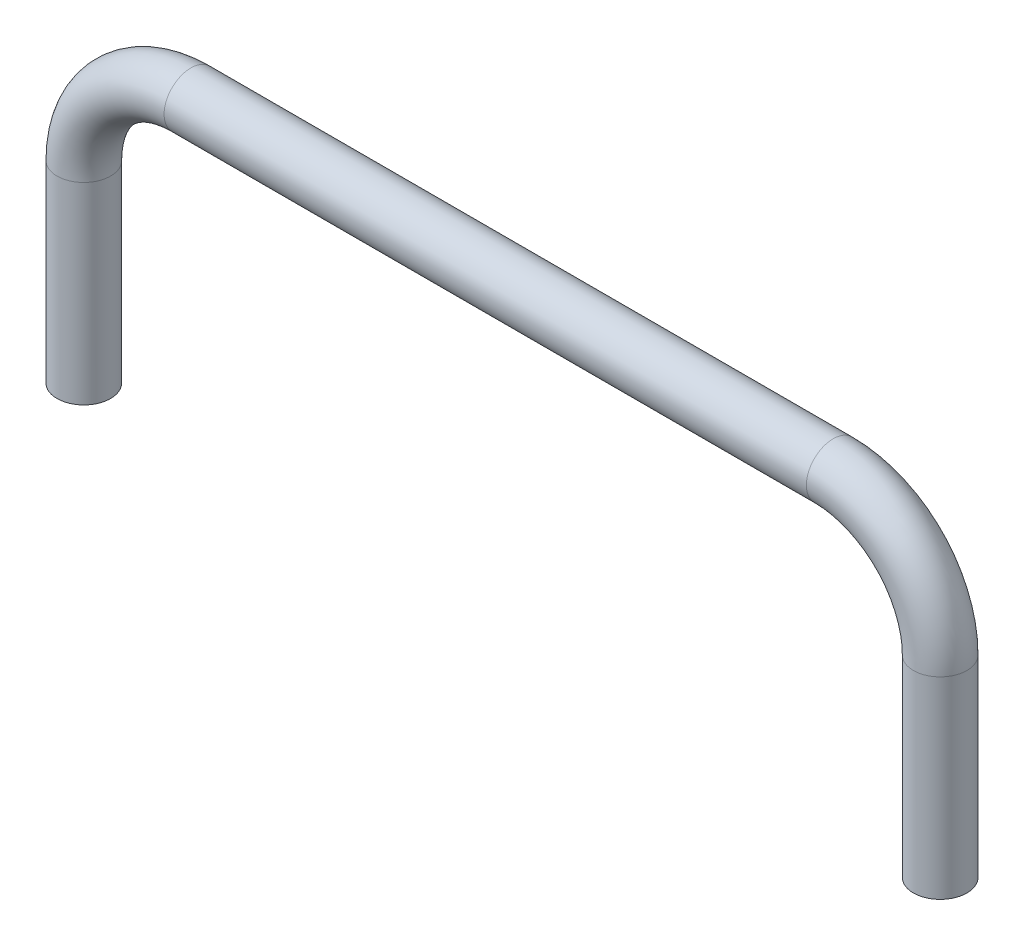
from build123d import *

# Parameters (mm, degrees)
SKETCH3_R = 3.175


with BuildPart() as part:
    # Sweep1: sweep along a path in Sketch2
    with BuildLine(Plane.XY) as sweep1_path:
        Line((-50.8, 0), (-50.8, 22.86))
        ThreePointArc((-50.8, 22.86), (-47.080256121, 31.840256121), (-38.1, 35.56))
        Line((-38.1, 35.56), (38.1, 35.56))
        ThreePointArc((38.1, 35.56), (47.080256121, 31.840256121), (50.8, 22.86))
        Line((50.8, 22.86), (50.8, 0))
    # Sketch3 → Sweep1 (sweep)
    with BuildSketch(Plane(origin=(0, 0, 0), x_dir=(1, 0, 0), z_dir=(0, 1, 0))):
        with Locations((-50.8, 0)):
            Circle(SKETCH3_R)
    sweep(path=sweep1_path.line)


solid = part.part
